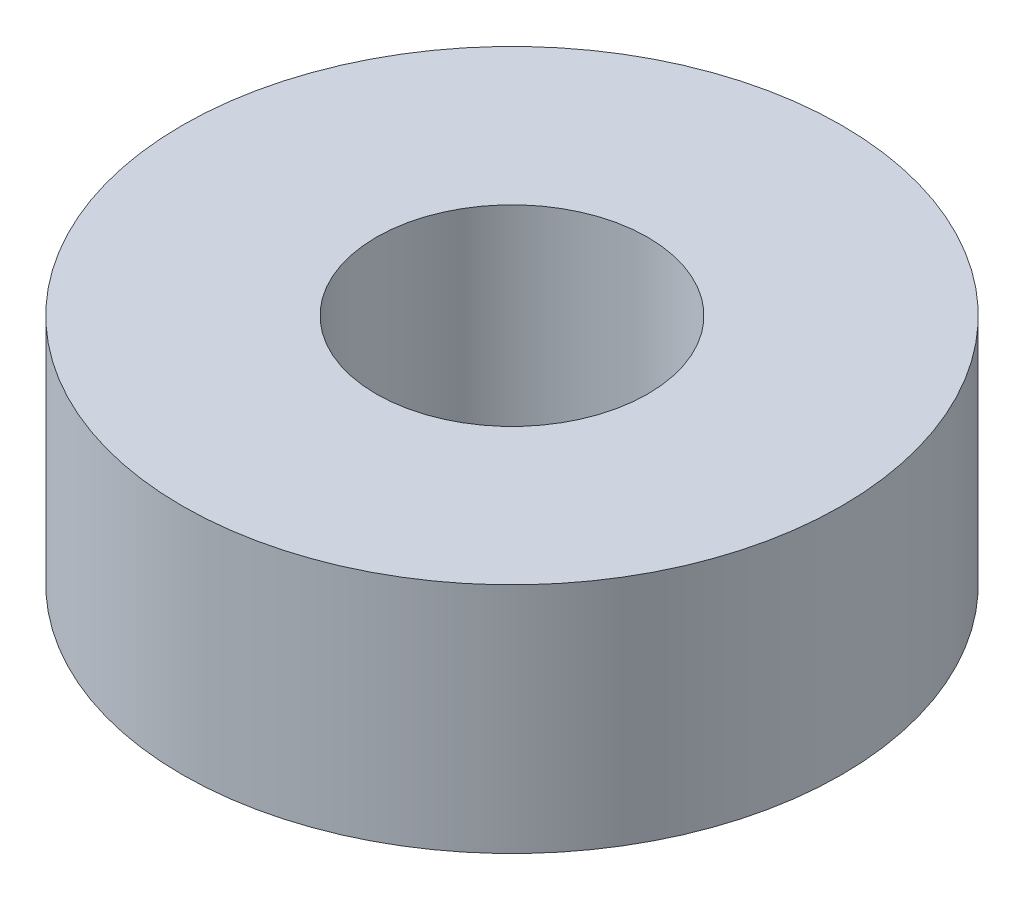
from build123d import *

# Parameters (mm, degrees)
SKETCH_1_R      = 8.5
SKETCH_1_R_2    = 3.5
EXTRUDE_1_DEPTH = 6


with BuildPart() as part:
    # 草图1 → 凸台-拉伸1 (new body)
    with BuildSketch(Plane(origin=(0, 0, 0), x_dir=(1, 0, 0), z_dir=(0, 1, 0))):
        with Locations(Location((0, 0, 0), (0, 0, 270))):
            Circle(SKETCH_1_R)
        with Locations(Location((0, 0, 0), (0, 0, 270))):
            Circle(SKETCH_1_R_2, mode=Mode.SUBTRACT)
    extrude(amount=EXTRUDE_1_DEPTH)


solid = part.part
